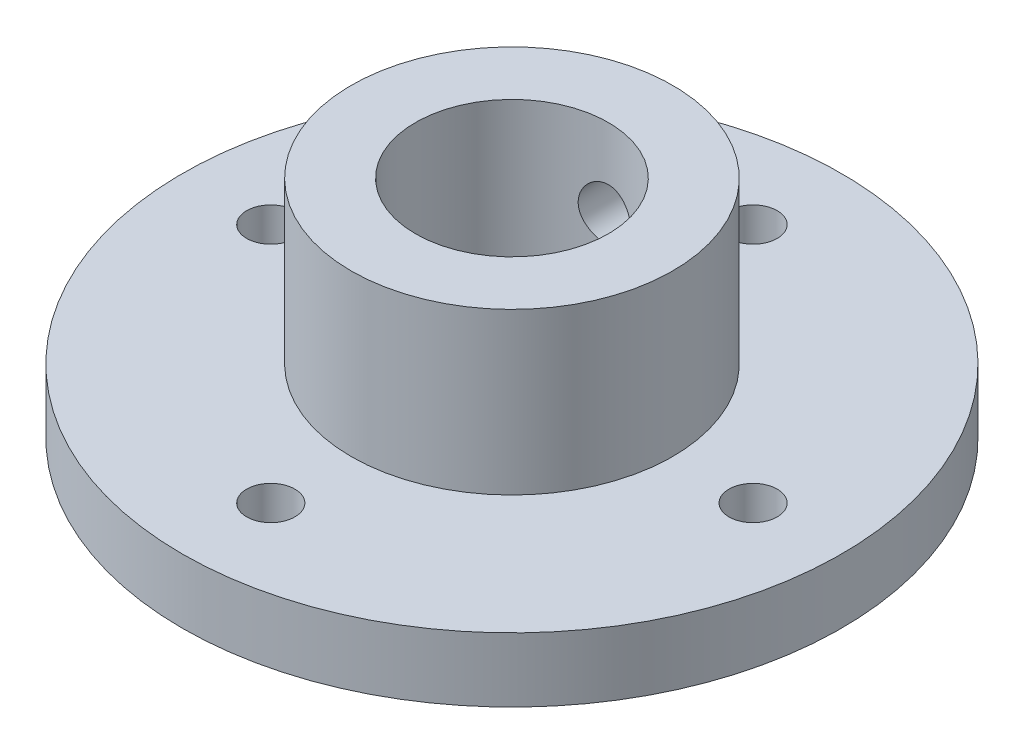
from build123d import *

# Parameters (mm, degrees)
CUT_EXTRUDE1_REACH     = 32.668
SKETCH4_R              = 1.5
M4_TAPPED_HOLE1_REACH  = 39.835
M4_TAPPED_HOLE1_BORE_R = 1.65


with BuildPart() as part:
    # Sketch1 → Revolve1 (revolve)
    with BuildSketch(Plane(origin=(0, 0, 0), x_dir=(0, 0, -1), z_dir=(1, 0, 0)), mode=Mode.PRIVATE) as revolve1_sk:
        Polygon((6, 0), (6, -14), (20.5, -14), (20.5, -10), (10, -10), (10, 0), align=None)
    revolve(revolve1_sk.sketch.rotate(Axis((0, 12.462470437, 0), (0, -1, 0)), 180), axis=Axis((0, 12.462470437, 0), (0, -1, 0)))

    # Sketch4 → Cut-Extrude1 (cut, up to next)
    with BuildSketch(Plane(origin=(0, -10, 0), x_dir=(1, 0, 0), z_dir=(0, 1, 0)), mode=Mode.PRIVATE) as cut_extrude1_sk1:
        with Locations(Location((0, 15, 0), (0, 0, 270))):
            Circle(SKETCH4_R)
    cut_extrude1_tool1 = extrude(cut_extrude1_sk1.sketch, amount=-CUT_EXTRUDE1_REACH, mode=Mode.PRIVATE) & part.part
    # Sketch4 → Cut-Extrude1 (cut, up to next)
    with BuildSketch(Plane(origin=(0, -10, 0), x_dir=(1, 0, 0), z_dir=(0, 1, 0)), mode=Mode.PRIVATE) as cut_extrude1_sk2:
        with Locations(Location((15, 0, 0), (0, 0, 270))):
            Circle(SKETCH4_R)
    cut_extrude1_tool2 = extrude(cut_extrude1_sk2.sketch, amount=-CUT_EXTRUDE1_REACH, mode=Mode.PRIVATE) & part.part
    # Sketch4 → Cut-Extrude1 (cut, up to next)
    with BuildSketch(Plane(origin=(0, -10, 0), x_dir=(1, 0, 0), z_dir=(0, 1, 0)), mode=Mode.PRIVATE) as cut_extrude1_sk3:
        with Locations(Location((0, -15, 0), (0, 0, 270))):
            Circle(SKETCH4_R)
    cut_extrude1_tool3 = extrude(cut_extrude1_sk3.sketch, amount=-CUT_EXTRUDE1_REACH, mode=Mode.PRIVATE) & part.part
    # Sketch4 → Cut-Extrude1 (cut, up to next)
    with BuildSketch(Plane(origin=(0, -10, 0), x_dir=(1, 0, 0), z_dir=(0, 1, 0)), mode=Mode.PRIVATE) as cut_extrude1_sk4:
        with Locations(Location((-15, 0, 0), (0, 0, 270))):
            Circle(SKETCH4_R)
    cut_extrude1_tool4 = extrude(cut_extrude1_sk4.sketch, amount=-CUT_EXTRUDE1_REACH, mode=Mode.PRIVATE) & part.part
    add(cut_extrude1_tool1.solids().sort_by_distance((0, -10, -15))[0], mode=Mode.SUBTRACT)
    add(cut_extrude1_tool2.solids().sort_by_distance((15, -10, 0))[0], mode=Mode.SUBTRACT)
    add(cut_extrude1_tool3.solids().sort_by_distance((0, -10, 15))[0], mode=Mode.SUBTRACT)
    add(cut_extrude1_tool4.solids().sort_by_distance((-15, -10, 0))[0], mode=Mode.SUBTRACT)

    # M4 Tapped Hole1 bore (on position points) → M4 Tapped Hole1 (cut, up to next)
    with BuildSketch(Plane(origin=(0, -5, -10), x_dir=(-1, 0, 0), z_dir=(0, 0, -1)), mode=Mode.PRIVATE) as m4_tapped_hole1_sk1:
        Circle(M4_TAPPED_HOLE1_BORE_R)
    m4_tapped_hole1_tool1 = extrude(m4_tapped_hole1_sk1.sketch, amount=-M4_TAPPED_HOLE1_REACH, mode=Mode.PRIVATE) & part.part
    add(m4_tapped_hole1_tool1.solids().sort_by_distance((0, -5, -10))[0], mode=Mode.SUBTRACT)


solid = part.part
